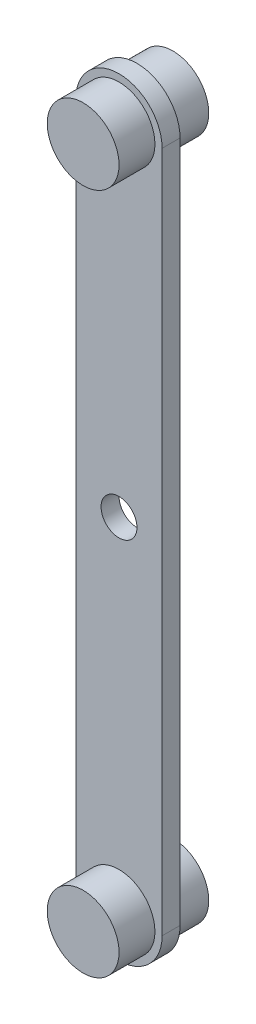
from build123d import *

# Parameters (mm, degrees)
BOSS_EXTRUDE1_DEPTH = 5
SKETCH2_R           = 10
BOSS_EXTRUDE2_DEPTH = 10
SKETCH3_R           = 5
CUT_EXTRUDE1_DEPTH  = 10
BOSS_EXTRUDE3_START = 10
SKETCH4_R           = 10
BOSS_EXTRUDE3_DEPTH = 10
BOSS_EXTRUDE4_DEPTH = 5
SKETCH9_R           = 5
CUT_EXTRUDE4_DEPTH  = 35


with BuildPart() as part:
    # Sketch1 → Boss-Extrude1 (new body)
    with BuildSketch(Plane.XY):
        with BuildLine():
            Line((10, 10), (10, 200))
            ThreePointArc((10, 200), (0, 210), (-10, 200))
            Line((-10, 200), (-10, 10))
            ThreePointArc((-10, 10), (0, 0), (10, 10))
        make_face()
    extrude(amount=BOSS_EXTRUDE1_DEPTH)

    # Sketch2 → Boss-Extrude2 (add)
    with BuildSketch(Plane.XY.offset(5)):
        with Locations((0, 200)):
            Circle(SKETCH2_R)
        with Locations((0, 10)):
            Circle(SKETCH2_R)
    extrude(amount=BOSS_EXTRUDE2_DEPTH)

    # Sketch3 → Cut-Extrude1 (cut)
    with BuildSketch(Plane(origin=(0, 0, 0), x_dir=(-1, 0, 0), z_dir=(0, 0, -1))):
        with Locations((0, 105)):
            Circle(SKETCH3_R)
    extrude(amount=-CUT_EXTRUDE1_DEPTH, mode=Mode.SUBTRACT)

    # Sketch4 → Boss-Extrude3 (add)
    with BuildSketch(Plane(origin=(0, 0, 0), x_dir=(-1, 0, 0), z_dir=(0, 0, -1)).offset(BOSS_EXTRUDE3_START)):
        with Locations((0, 200)):
            Circle(SKETCH4_R)
        with Locations((0, 10)):
            Circle(SKETCH4_R)
    extrude(amount=-BOSS_EXTRUDE3_DEPTH)

    # Sketch5 → Boss-Extrude4 (add)
    with BuildSketch(Plane(origin=(0, 0, 0), x_dir=(-1, 0, 0), z_dir=(0, 0, -1))):
        with BuildLine():
            Line((12, 200), (12, 10))
            ThreePointArc((12, 10), (0, -2), (-12, 10))
            Line((-12, 10), (-12, 200))
            ThreePointArc((-12, 200), (0, 212), (12, 200))
        make_face()
    extrude(amount=-BOSS_EXTRUDE4_DEPTH)

    # Sketch9 → Cut-Extrude4 (cut)
    with BuildSketch(Plane(origin=(0, 0, 0), x_dir=(-1, 0, 0), z_dir=(0, 0, -1))):
        with Locations((0, 105)):
            Circle(SKETCH9_R)
    extrude(amount=-CUT_EXTRUDE4_DEPTH, mode=Mode.SUBTRACT)


solid = part.part
